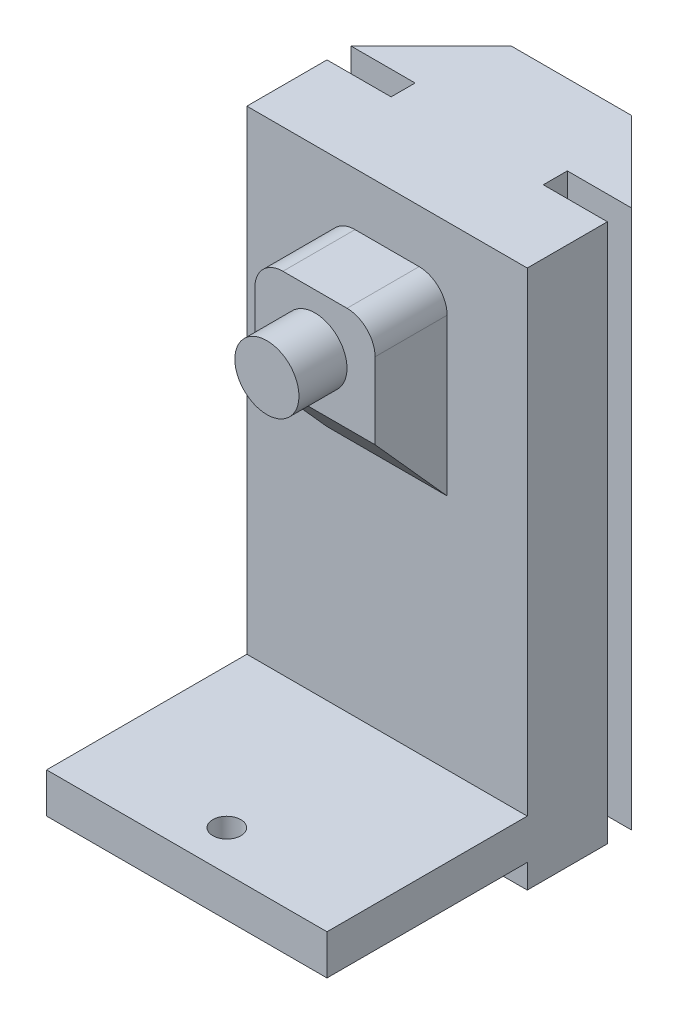
from build123d import *

# Parameters (mm, degrees)
SALIENTE_EXTRUIR1_DEPTH  = 67.25
CROQUIS7_R               = 4
SALIENTE_EXTRUIR2_DEPTH  = 15
SALIENTE_EXTRUIR9_DEPTH  = 7.5
CROQUIS15_R              = 4
SALIENTE_EXTRUIR15_DEPTH = 9
CROQUIS17_W              = 25
CROQUIS17_H              = 5
SALIENTE_EXTRUIR16_DEPTH = 17.5
CROQUIS18_R              = 1.75
CORTAR_EXTRUIR3_DEPTH    = 7.5


with BuildPart() as part:
    # Croquis2 → Saliente-Extruir1 (new body)
    with BuildSketch(Plane(origin=(0, 0, 0), x_dir=(1, 0, 0), z_dir=(0, 1, 0))):
        Polygon((-17.5, -27.121137051), (17.5, -27.121137051), (17.5, -17.121137051), (9.5, -17.121137051), (9.5, -14.121137051), (17.5, -14.121137051), (7.5, -4.121137051), (-7.5, -4.121137051), (-17.5, -14.121137051), (-9.5, -14.121137051), (-9.5, -17.121137051), (-17.5, -17.121137051), align=None)
    extrude(amount=SALIENTE_EXTRUIR1_DEPTH)

    # Croquis7 → Saliente-Extruir2 (add)
    with BuildSketch(Plane.XY.offset(27.121137051)):
        with Locations(Location((0, 54.15, 0), (0, 0, 180))):
            Circle(CROQUIS7_R)
    extrude(amount=SALIENTE_EXTRUIR2_DEPTH)



with BuildPart() as body_2:
    # Croquis8 → Saliente-Extruir9 (new, symmetric)
    with BuildSketch(Plane(origin=(0, 0, 0), x_dir=(0, 0, -1), z_dir=(1, 0, 0))):
        Polygon((-36.121137051, 47.65), (-30.523413607, 47.65), (-27.121137051, 47.65), (-27.121137051, 37.610022974), align=None)
    extrude(amount=SALIENTE_EXTRUIR9_DEPTH, both=True)


with BuildPart() as part_1:
    add(part.part)

    add(body_2.part)  # Saliente-Extruir15 merges body 2
    # Croquis15 → Saliente-Extruir15 (add)
    with BuildSketch(Plane.XY.offset(27.121137051)):
        with BuildLine():
            Line((-7.5, 47.65), (7.5, 47.65))
            Line((7.5, 47.65), (7.5, 57.15))
            ThreePointArc((7.5, 57.15), (6.474873734, 59.624873734), (4, 60.65))
            Line((4, 60.65), (-4, 60.65))
            ThreePointArc((-4, 60.65), (-6.474873734, 59.624873734), (-7.5, 57.15))
            Line((-7.5, 57.15), (-7.5, 47.65))
        make_face()
        with Locations(Location((0, 54.15, 0), (0, 0, 180))):
            Circle(CROQUIS15_R, mode=Mode.SUBTRACT)
    extrude(amount=SALIENTE_EXTRUIR15_DEPTH)

    # Croquis17 → Saliente-Extruir16 (add, symmetric)
    with BuildSketch(Plane(origin=(0, 0, 0), x_dir=(0, 0, -1), z_dir=(1, 0, 0))):
        with Locations((-39.621137051, 5.5)):
            Rectangle(CROQUIS17_W, CROQUIS17_H)
    extrude(amount=SALIENTE_EXTRUIR16_DEPTH, both=True)

    # Croquis18 → Cortar-Extruir3 (cut, symmetric)
    with BuildSketch(Plane(origin=(0, 8, 0), x_dir=(1, 0, 0), z_dir=(0, 1, 0))):
        with Locations(Location((0, -47.121137051, 0), (0, 0, 270))):
            Circle(CROQUIS18_R)
    extrude(amount=CORTAR_EXTRUIR3_DEPTH, both=True, mode=Mode.SUBTRACT)


solid = part_1.part
